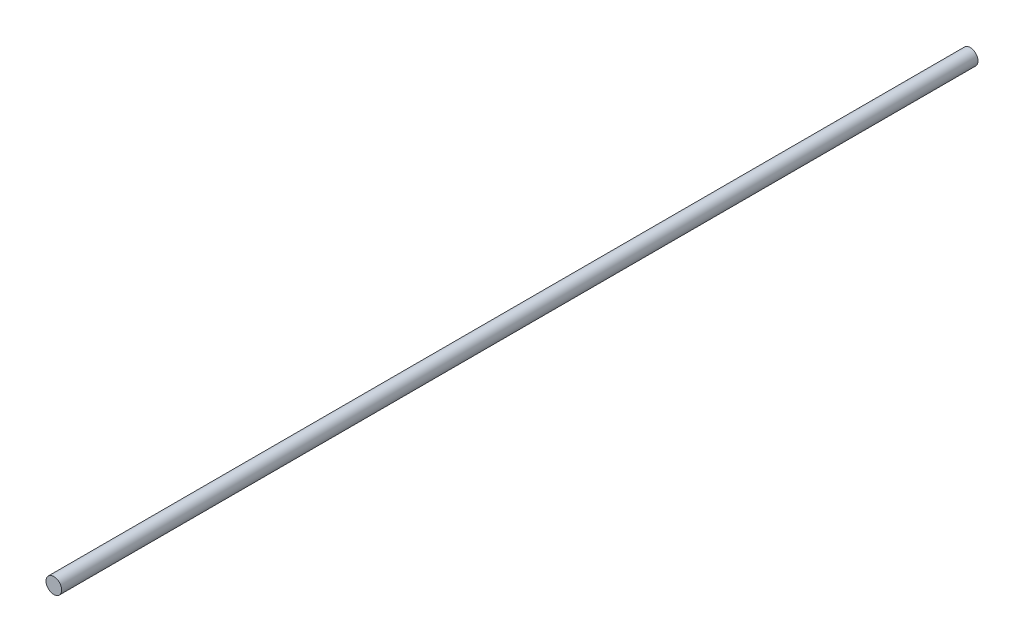
from build123d import *

# Parameters (mm, degrees)
SKETCH1_R           = 4.7625
BOSS_EXTRUDE1_DEPTH = 558.8


with BuildPart() as part:
    # Sketch1 → Boss-Extrude1 (new body)
    with BuildSketch(Plane.XY):
        Circle(SKETCH1_R)
    extrude(amount=BOSS_EXTRUDE1_DEPTH)


solid = part.part
